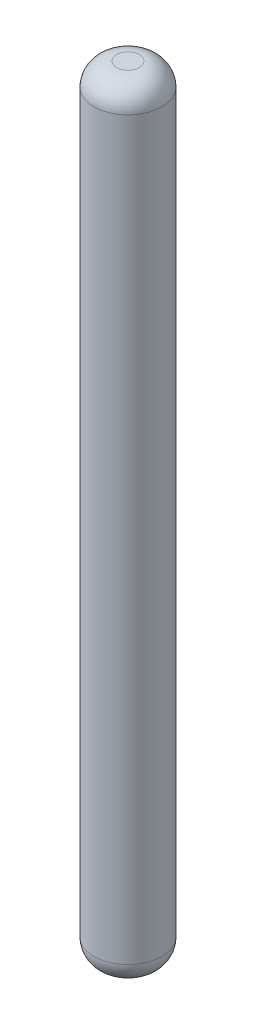
from build123d import *

# Parameters (mm, degrees)
SKETCH1_R           = 1.5
BOSS_EXTRUDE1_DEPTH = 34.5
FILLET1_R           = 1


with BuildPart() as part:
    # Sketch1 → Boss-Extrude1 (new body)
    with BuildSketch(Plane(origin=(0, 0, 0), x_dir=(1, 0, 0), z_dir=(0, 1, 0))):
        with Locations(Location((0, 0, 0), (0, 0, 270))):
            Circle(SKETCH1_R)
    extrude(amount=BOSS_EXTRUDE1_DEPTH)

    # Fillet1
    fillet1_edges = [part.edges().sort_by_distance(p)[0] for p in [
        (0, 0, -1.5),
        (0, 34.5, -1.5),
    ]]
    fillet(fillet1_edges, radius=FILLET1_R)


solid = part.part
